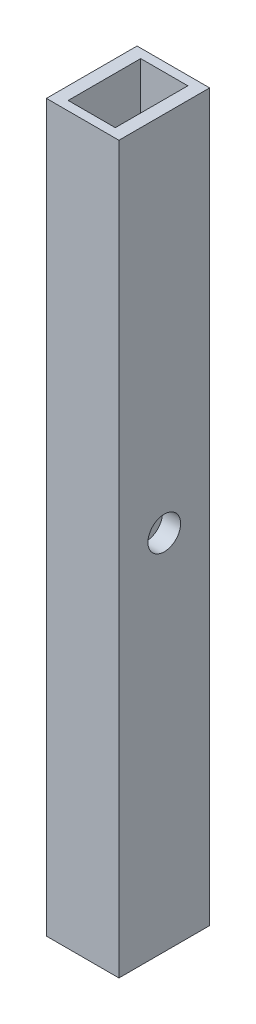
from build123d import *

# Parameters (mm, degrees)
SKETCH1_W           = 100
SKETCH1_H           = 125
BOSS_EXTRUDE1_DEPTH = 500
SKETCH2_R           = 22.5
CUT_EXTRUDE1_DEPTH  = 25
CUT_EXTRUDE2_START  = -25
SKETCH3_R           = 22.5
CUT_EXTRUDE2_DEPTH  = 25
SKETCH4_W           = 65
SKETCH4_H           = 100
CUT_EXTRUDE3_DEPTH  = 400


with BuildPart() as part:
    # Sketch1 → Boss-Extrude1 (new, symmetric)
    with BuildSketch(Plane(origin=(0, 0, 0), x_dir=(1, 0, 0), z_dir=(0, 1, 0))):
        Rectangle(SKETCH1_W, SKETCH1_H)
    extrude(amount=BOSS_EXTRUDE1_DEPTH, both=True)

    # Sketch2 → Cut-Extrude1 (cut)
    with BuildSketch(Plane(origin=(50, 0, 0), x_dir=(0, 0, -1), z_dir=(1, 0, 0))):
        Circle(SKETCH2_R)
    extrude(amount=-CUT_EXTRUDE1_DEPTH, mode=Mode.SUBTRACT)

    # Sketch3 → Cut-Extrude2 (cut)
    with BuildSketch(Plane.ZY.offset(50).offset(CUT_EXTRUDE2_START)):
        with Locations(Location((0, 0, 0), (0, 0, 180))):
            Circle(SKETCH3_R)
    extrude(amount=CUT_EXTRUDE2_DEPTH, mode=Mode.SUBTRACT)

    # Sketch4 → Cut-Extrude3 (cut)
    with BuildSketch(Plane(origin=(0, 500, 0), x_dir=(1, 0, 0), z_dir=(0, 1, 0))):
        Rectangle(SKETCH4_W, SKETCH4_H)
    extrude(amount=-CUT_EXTRUDE3_DEPTH, mode=Mode.SUBTRACT)


solid = part.part
